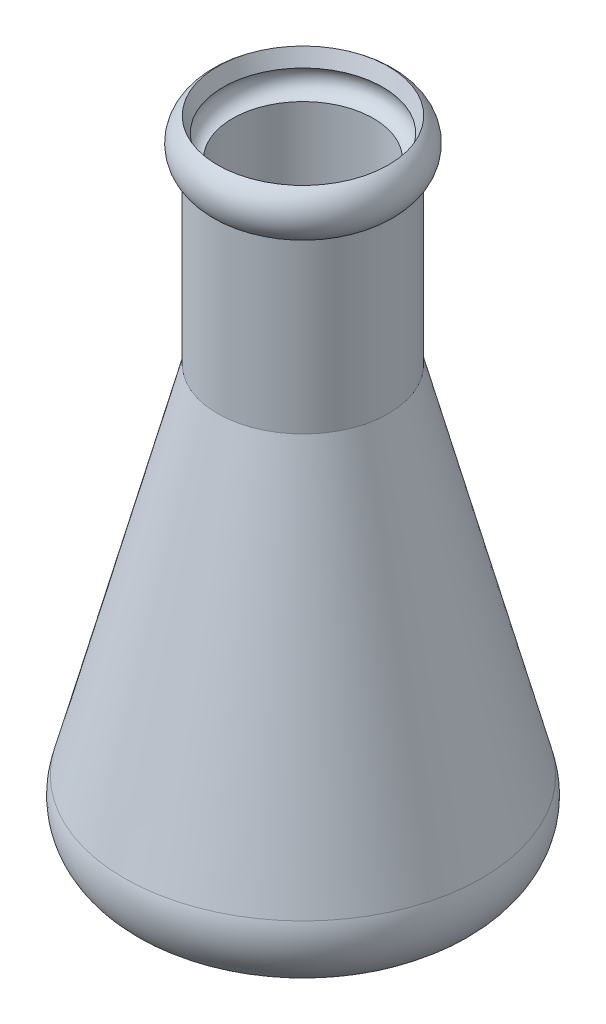
from build123d import *


with BuildPart() as part:
    # Sketch1 → Revolve1 (revolve)
    with BuildSketch(Plane.XY):
        with BuildLine():
            Line((11.36894359, -6.315125633), (11.36894359, -28.655158183))
            Line((11.36894359, -28.655158183), (23.78910836, -76.005260823))
            ThreePointArc((23.78910836, -76.005260823), (23.619975063, -81.109245479), (20.312212269, -85))
            Line((20.312212269, -85), (0, -85))
            Line((0, -85), (0, -83))
            Line((0, -83), (2, -83))
            Line((2, -83), (19.724958515, -83))
            ThreePointArc((19.724958515, -83), (21.847263271, -80.130008508), (21.867118705, -76.560605981))
            Line((21.867118705, -76.560605981), (9.36894359, -28.913100051))
            Line((9.36894359, -28.913100051), (9.36894359, -4.98823705))
            ThreePointArc((9.36894359, -4.98823705), (10.882135633, -3.865208891), (10.61392266, -2))
            Line((10.61392266, -2), (11.36894359, 0))
            ThreePointArc((11.36894359, 0), (13.023652288, -3.157562817), (11.36894359, -6.315125633))
        make_face()
    revolve(axis=Axis((0, -85, 0), (0, 1, 0)))


solid = part.part
